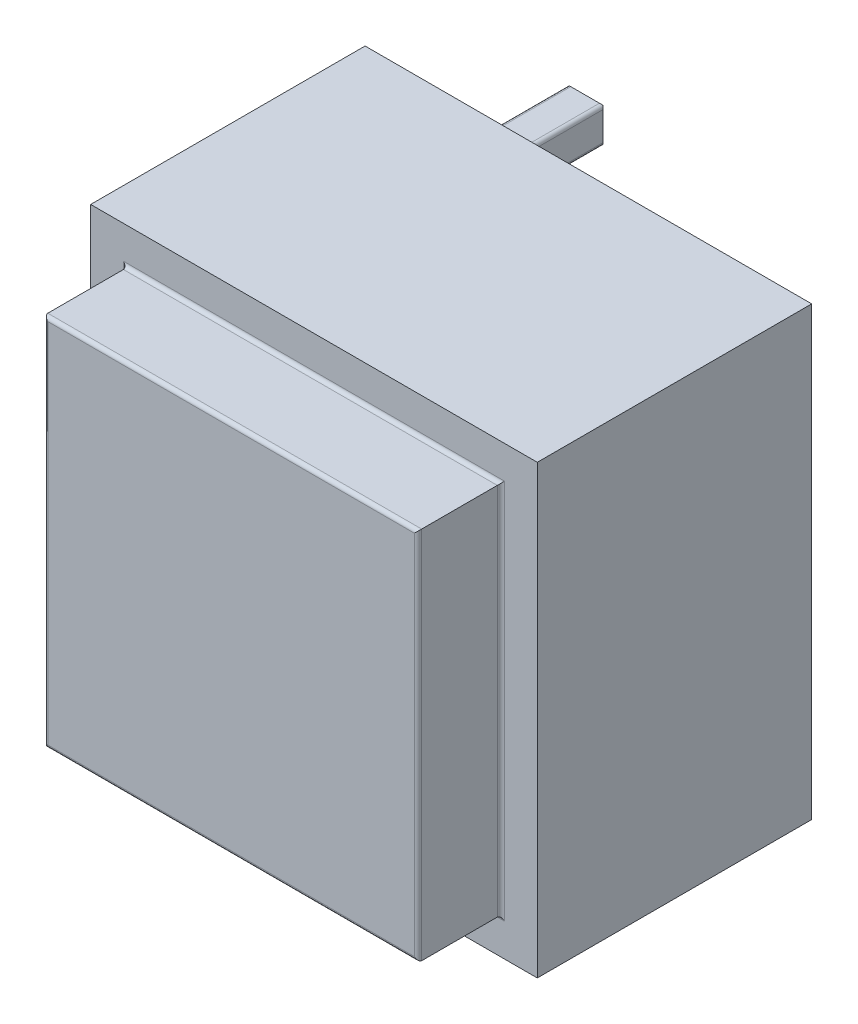
from build123d import *

# Parameters (mm, degrees)
SKETCH1_W           = 12.319
SKETCH1_H           = 12.319
BOSS_EXTRUDE1_DEPTH = 7.5692
SKETCH2_W           = 10.3124
SKETCH2_H           = 10.3124
BOSS_EXTRUDE2_DEPTH = 2.286
SKETCH3_R           = 0.6096
BOSS_EXTRUDE5_DEPTH = 1.4986
FILLET2_R           = 0.5
FILLET3_R           = 0.1
SKETCH5_W           = 0.9906
SKETCH5_H           = 0.9906
BOSS_EXTRUDE6_DEPTH = 3.8608
CHAMFER1_SIZE       = 0.1
FILLET4_R           = 0.1
FILLET5_R           = 0.1
FILLET6_R           = 0.1
FILLET7_R           = 0.1


with BuildPart() as part:
    # Sketch1 → Boss-Extrude1 (new body)
    with BuildSketch(Plane.XY):
        Rectangle(SKETCH1_W, SKETCH1_H)
    extrude(amount=BOSS_EXTRUDE1_DEPTH)

    # Sketch2 → Boss-Extrude2 (add)
    with BuildSketch(Plane.XY.offset(7.5692)):
        Rectangle(SKETCH2_W, SKETCH2_H)
    extrude(amount=BOSS_EXTRUDE2_DEPTH)

    # Sketch3 → Boss-Extrude5 (add)
    with BuildSketch(Plane(origin=(0, 0, 0), x_dir=(-1, 0, 0), z_dir=(0, 0, -1))):
        with Locations((-1.2295, 1.2295)):
            Circle(SKETCH3_R)
        with Locations((-3.7695, -1.3105)):
            Circle(SKETCH3_R)
    extrude(amount=BOSS_EXTRUDE5_DEPTH)

    # Fillet2
    fillet2_edges = [part.edges().sort_by_distance(p)[0] for p in [
        (1.8391, 1.2295, -1.4986),
        (4.3791, -1.3105, -1.4986),
    ]]
    fillet(fillet2_edges, radius=FILLET2_R)

    # Fillet3
    fillet3_edges = [part.edges().sort_by_distance(p)[0] for p in [
        (1.8391, 1.2295, 0),
        (4.3791, -1.3105, 0),
    ]]
    fillet(fillet3_edges, radius=FILLET3_R)

    # Sketch5 → Boss-Extrude6 (add)
    with BuildSketch(Plane(origin=(0, 0, 0), x_dir=(-1, 0, 0), z_dir=(0, 0, -1))):
        with Locations((3.8505, -3.8505)):
            Rectangle(SKETCH5_W, SKETCH5_H)
        with Locations((3.8505, 3.7695)):
            Rectangle(SKETCH5_W, SKETCH5_H)
    extrude(amount=BOSS_EXTRUDE6_DEPTH)

    # Chamfer1
    chamfer1_edges = [part.edges().sort_by_distance(p)[0] for p in [
        (-3.8505, -3.3552, -3.8608),
        (-3.3552, -3.8505, -3.8608),
        (-3.8505, -4.3458, -3.8608),
        (-4.3458, -3.8505, -3.8608),
        (-3.3552, 3.7695, -3.8608),
        (-3.8505, 4.2648, -3.8608),
        (-3.8505, 3.2742, -3.8608),
        (-4.3458, 3.7695, -3.8608),
    ]]
    chamfer(chamfer1_edges, length=CHAMFER1_SIZE)

    # Fillet4
    fillet4_edges = [part.edges().sort_by_distance(p)[0] for p in [
        (-3.8505, -4.3458, 0),
        (-4.3458, -3.8505, 0),
        (-3.8505, -3.3552, 0),
        (-3.3552, -3.8505, 0),
        (-3.8505, 3.2742, 0),
        (-4.3458, 3.7695, 0),
        (-3.3552, 3.7695, 0),
        (-3.8505, 4.2648, 0),
    ]]
    fillet(fillet4_edges, radius=FILLET4_R)

    # Fillet5
    fillet5_edges = [part.edges().sort_by_distance(p)[0] for p in [
        (5.1562, 0, 7.5692),
        (0, 5.1562, 7.5692),
        (-5.1562, 0, 7.5692),
        (0, -5.1562, 7.5692),
    ]]
    fillet(fillet5_edges, radius=FILLET5_R)

    # Fillet6
    fillet6_edges = [part.edges().sort_by_distance(p)[0] for p in [
        (-4.381195109, 3.238804891, -0.023670398),
        (-4.381195109, 4.300195109, -0.023670398),
        (-3.319804891, 3.238804891, -0.023670398),
        (-3.319804891, 4.300195109, -0.023670398),
        (-3.319804891, -4.381195109, -0.023670398),
        (-4.381195109, -4.381195109, -0.023670398),
        (-3.319804891, -3.319804891, -0.023670398),
        (-4.381195109, -3.319804891, -0.023670398),
        (-3.3552, -4.3458, -1.9304),
        (-3.3552, -3.3552, -1.9304),
        (-4.3458, -4.3458, -1.9304),
        (-4.3458, -3.3552, -1.9304),
        (-3.3552, 3.2742, -1.9304),
        (-3.3552, 4.2648, -1.9304),
        (-4.3458, 3.2742, -1.9304),
        (-4.3458, 4.2648, -1.9304),
    ]]
    fillet(fillet6_edges, radius=FILLET6_R)

    # Fillet7
    fillet7_edges = [part.edges().sort_by_distance(p)[0] for p in [
        (5.1562, 0, 9.8552),
        (0, 5.1562, 9.8552),
        (-5.1562, 0, 9.8552),
        (0, -5.1562, 9.8552),
    ]]
    fillet(fillet7_edges, radius=FILLET7_R)


solid = part.part
